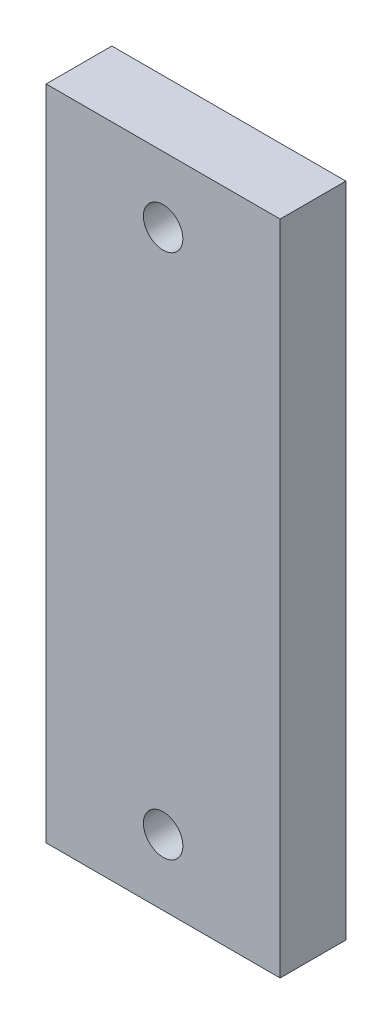
from build123d import *

# Parameters (mm, degrees)
SKETCH_1_W      = 17.8
SKETCH_1_H      = 50
SKETCH_1_R      = 1.5
EXTRUDE_1_DEPTH = 5


with BuildPart() as part:
    # 草图1 → 凸台-拉伸1 (new body)
    with BuildSketch(Plane.XY):
        Rectangle(SKETCH_1_W, SKETCH_1_H)
        with Locations((0, -20)):
            Circle(SKETCH_1_R, mode=Mode.SUBTRACT)
        with Locations((0, 20)):
            Circle(SKETCH_1_R, mode=Mode.SUBTRACT)
    extrude(amount=EXTRUDE_1_DEPTH)


solid = part.part
